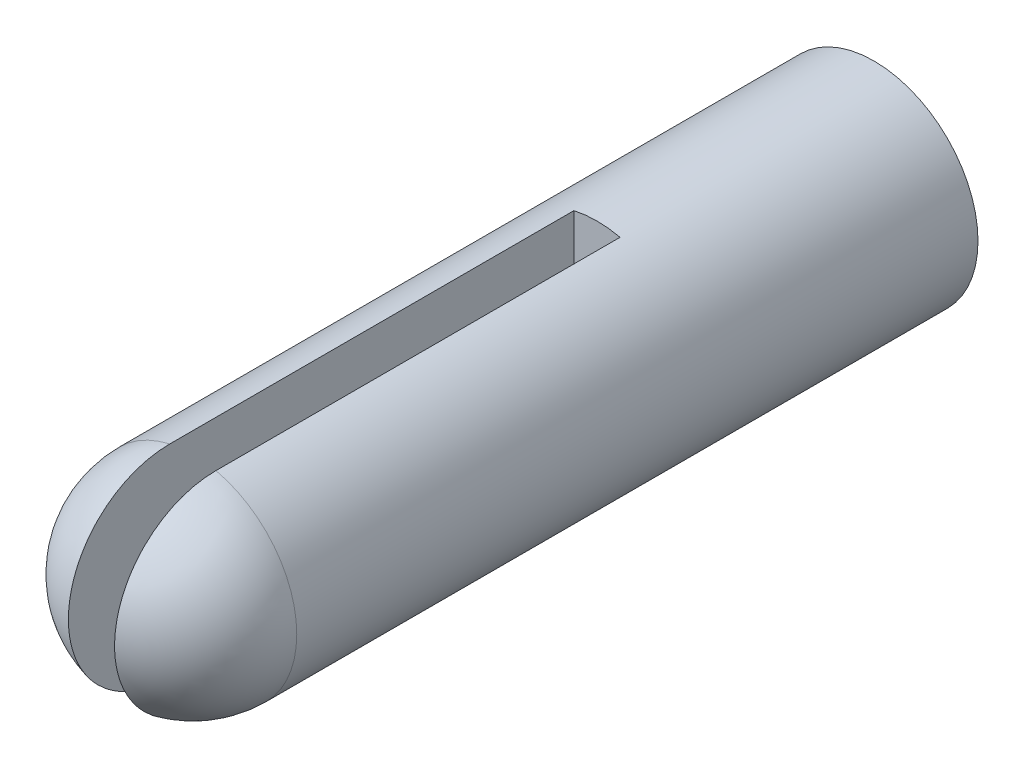
from build123d import *

# Parameters (mm, degrees)
SKETCH1_R           = 45
BOSS_EXTRUDE1_DEPTH = 340
FILLET1_R           = 45
SKETCH2_OUTSIDE_W   = 414.608
SKETCH2_OUTSIDE_H   = 164.608
SKETCH2_OUTSIDE_W_2 = 150
SKETCH2_OUTSIDE_H_2 = 90
CUT_EXTRUDE1_DEPTH  = 10


with BuildPart() as part:
    # Sketch1 → Boss-Extrude1 (new body)
    with BuildSketch(Plane.XY):
        Circle(SKETCH1_R)
    extrude(amount=BOSS_EXTRUDE1_DEPTH)

    # Fillet1
    fillet1_edges = [part.edges().sort_by_distance(p)[0] for p in [
        (-45, 0, 340),
    ]]
    fillet(fillet1_edges, radius=FILLET1_R)

    # Sketch2 outside → Cut-Extrude1 (cut, symmetric)
    with BuildSketch(Plane(origin=(0, 0, 0), x_dir=(0, 0, -1), z_dir=(1, 0, 0))):
        with Locations((-170, 0)):
            Rectangle(SKETCH2_OUTSIDE_W, SKETCH2_OUTSIDE_H)
        with Locations((-45, 0)):
            Rectangle(SKETCH2_OUTSIDE_W_2, SKETCH2_OUTSIDE_H_2, mode=Mode.SUBTRACT)
    extrude(amount=CUT_EXTRUDE1_DEPTH, both=True, mode=Mode.SUBTRACT)


solid = part.part
